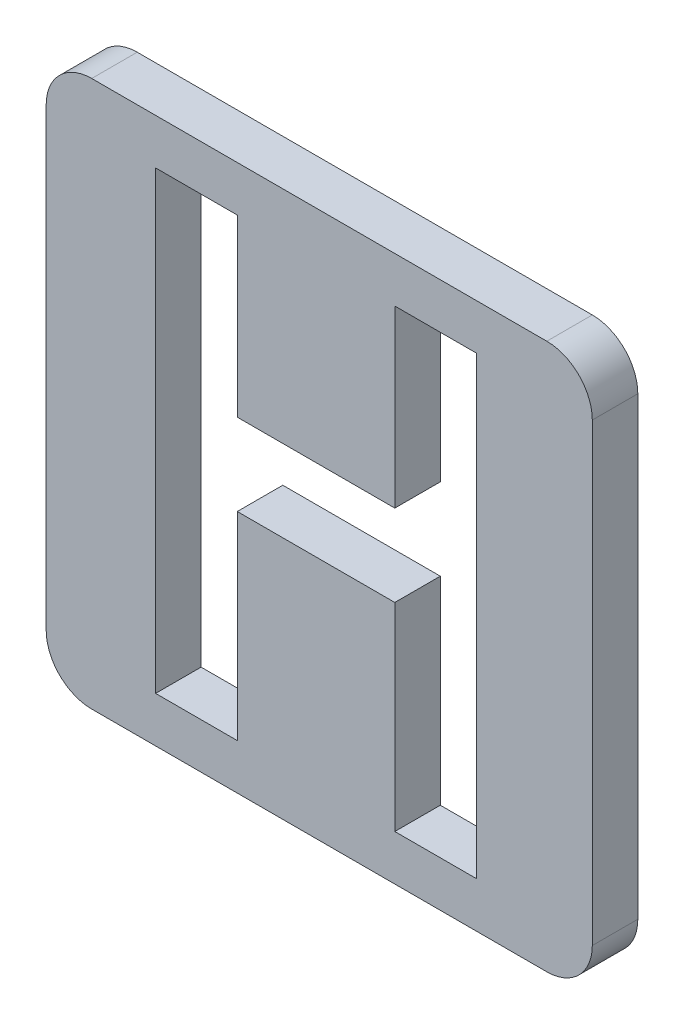
from build123d import *

# Parameters (mm, degrees)
BOSS_EXTRUDE1_DEPTH = 10
CUT_EXTRUDE21_DEPTH = 10


with BuildPart() as part:
    # Sketch1 → Boss-Extrude1 (new body)
    with BuildSketch(Plane.XY):
        with BuildLine():
            Line((-50, 60), (50, 60))
            ThreePointArc((50, 60), (57.071067812, 57.071067812), (60, 50))
            Line((60, 50), (60, -50))
            ThreePointArc((60, -50), (57.071067812, -57.071067812), (50, -60))
            Line((50, -60), (-50, -60))
            ThreePointArc((-50, -60), (-57.071067812, -57.071067812), (-60, -50))
            Line((-60, -50), (-60, 50))
            ThreePointArc((-60, 50), (-57.071067812, 57.071067812), (-50, 60))
        make_face()
    extrude(amount=BOSS_EXTRUDE1_DEPTH)

    # Sketch2 → Cut-Extrude21 (cut)
    with BuildSketch(Plane.XY.offset(10)):
        Polygon((-35.961538462, 50), (-18.012820513, 50), (-18.012820513, 11.538461538), (16.602564103, 11.538461538), (16.602564103, 50), (34.551282051, 50), (34.551282051, -50), (16.602564103, -50), (16.602564103, -6.41025641), (-18.012820513, -6.41025641), (-18.012820513, -50), (-35.961538462, -50), align=None)
    extrude(amount=-CUT_EXTRUDE21_DEPTH, mode=Mode.SUBTRACT)


solid = part.part
